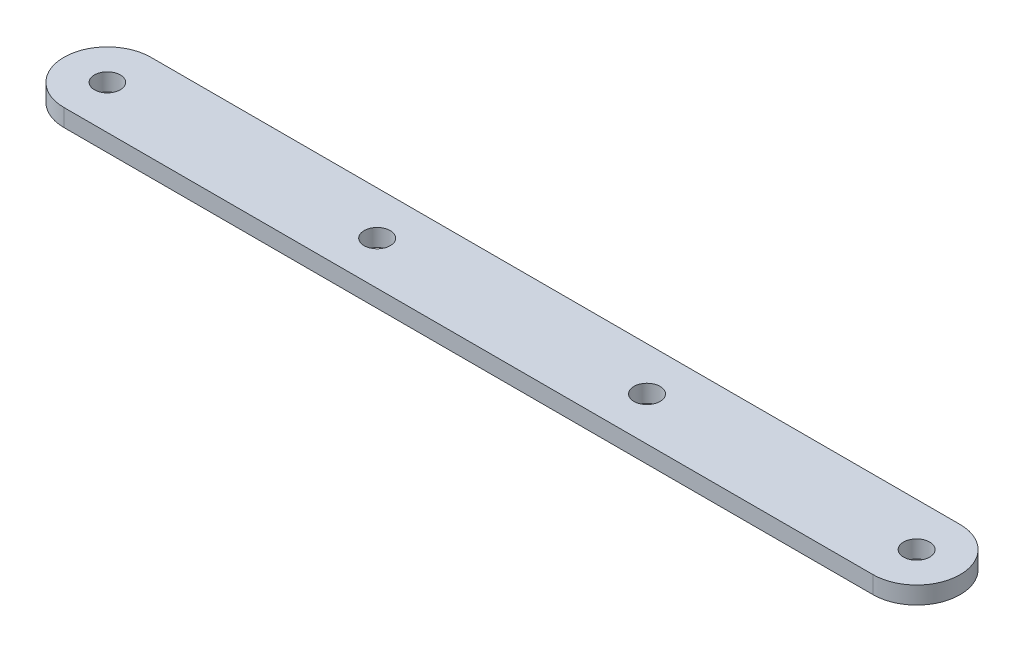
from build123d import *

# Parameters (mm, degrees)
SKETCH1_R           = 2.975
SKETCH1_R_2         = 3.01
BOSS_EXTRUDE1_DEPTH = 4


with BuildPart() as part:
    # Sketch1 → Boss-Extrude1 (new body)
    with BuildSketch(Plane(origin=(0, 0, 0), x_dir=(1, 0, 0), z_dir=(0, 1, 0))):
        with BuildLine():
            Line((-124.1, 10), (62, 10))
            ThreePointArc((62, 10), (72, 0), (62, -10))
            Line((62, -10), (-124.1, -10))
            ThreePointArc((-124.1, -10), (-134.1, 0), (-124.1, 10))
        make_face()
        with Locations(Location((-124.1, 0, 0), (0, 0, 270))):
            Circle(SKETCH1_R, mode=Mode.SUBTRACT)
        with Locations(Location((-62.05, 0, 0), (0, 0, 270))):
            Circle(SKETCH1_R_2, mode=Mode.SUBTRACT)
        with Locations(Location((0, 0, 0), (0, 0, 270))):
            Circle(SKETCH1_R_2, mode=Mode.SUBTRACT)
        with Locations(Location((62, 0, 0), (0, 0, 270))):
            Circle(SKETCH1_R_2, mode=Mode.SUBTRACT)
    extrude(amount=BOSS_EXTRUDE1_DEPTH)


solid = part.part
